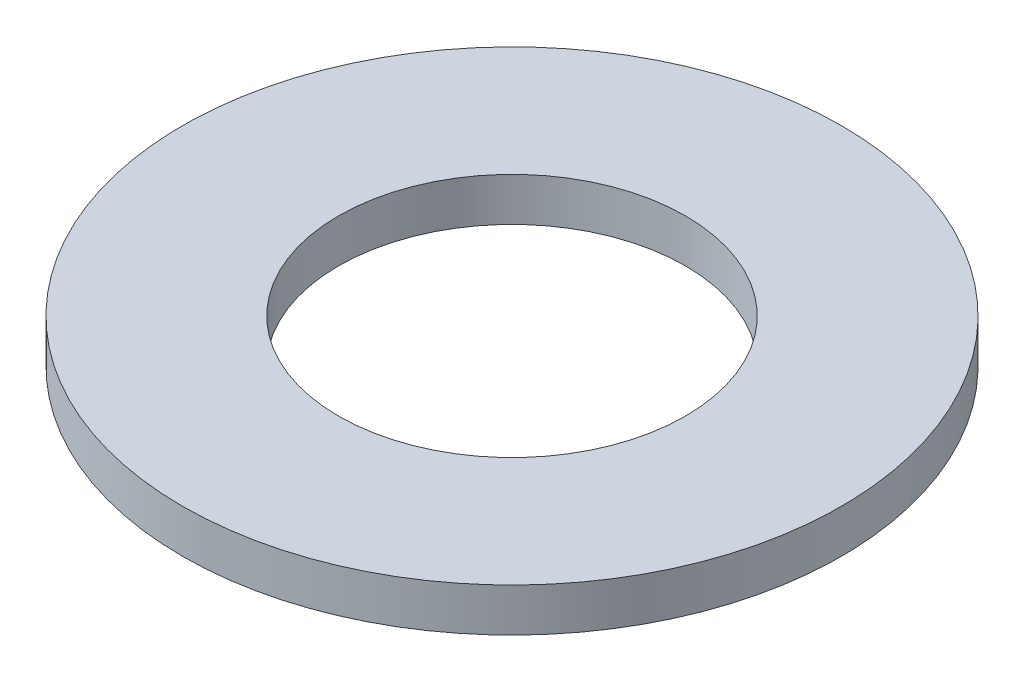
from build123d import *

# Parameters (mm, degrees)
SKETCH1_R           = 38
SKETCH1_R_2         = 20
BOSS_EXTRUDE1_DEPTH = 5


with BuildPart() as part:
    # Sketch1 → Boss-Extrude1 (new body)
    with BuildSketch(Plane(origin=(0, 0, 0), x_dir=(1, 0, 0), z_dir=(0, 1, 0))):
        with Locations(Location((0, 0, 0), (0, 0, 270))):
            Circle(SKETCH1_R)
        with Locations(Location((0, 0, 0), (0, 0, 270))):
            Circle(SKETCH1_R_2, mode=Mode.SUBTRACT)
    extrude(amount=BOSS_EXTRUDE1_DEPTH)


solid = part.part
